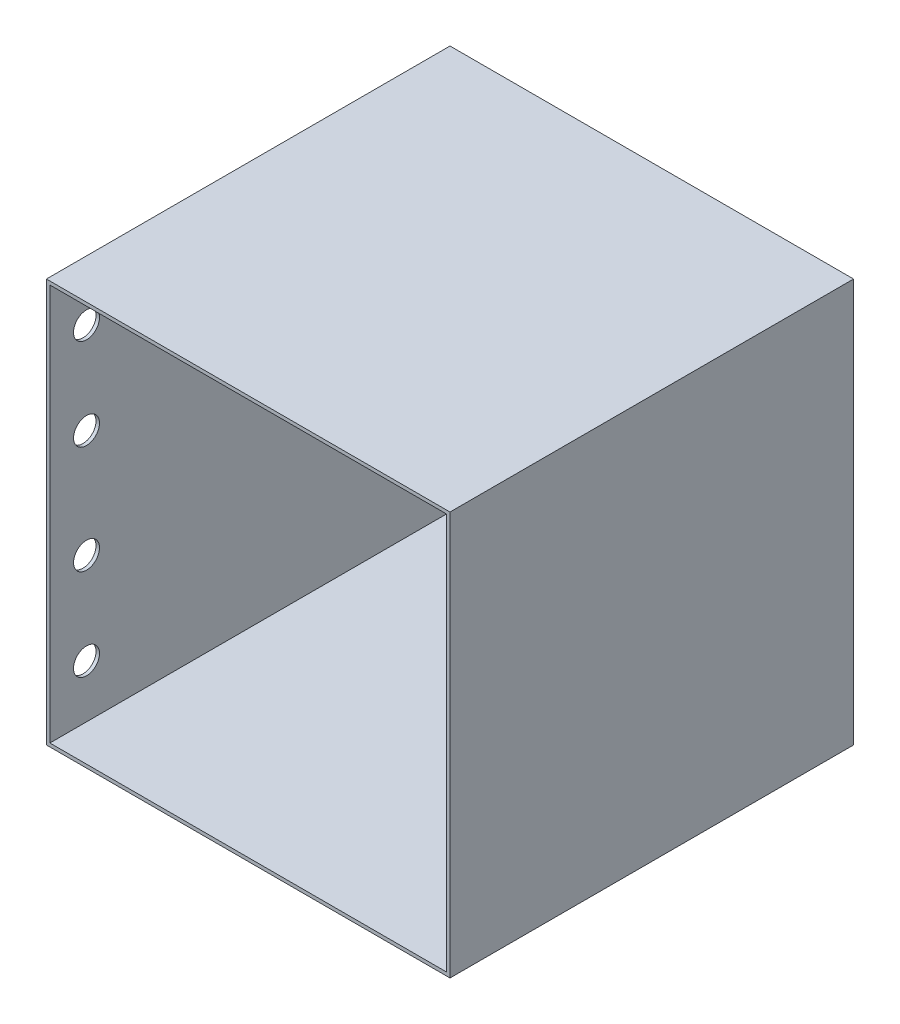
from build123d import *

# Parameters (mm, degrees)
CROQUIS1_W                        = 70
CROQUIS1_H                        = 70
SALIENTE_EXTRUIR1_DEPTH           = 70
VACIADO1_T                        = -0.6
TALADRO_DE_MARGEN_PARA_M41_REACH  = 173.7
TALADRO_DE_MARGEN_PARA_M41_BORE_R = 2.25


with BuildPart() as part:
    # Croquis1 → Saliente-Extruir1 (new body)
    with BuildSketch(Plane.XY):
        with Locations((35, 35)):
            Rectangle(CROQUIS1_W, CROQUIS1_H)
    extrude(amount=SALIENTE_EXTRUIR1_DEPTH)

    # Vaciado1
    vaciado1_openings = [part.faces().sort_by_distance(p)[0] for p in [
        (35, 35, 70),
        (35, 35, 0),
    ]]
    offset(amount=VACIADO1_T, openings=vaciado1_openings, kind=Kind.INTERSECTION)

    # Taladro de margen para M41 bore → Taladro de margen para M41 (cut, up to next)
    with BuildSketch(Plane(origin=(-1, -81.2, 39.730415546), x_dir=(0, 1, 0), z_dir=(-1, 0, 0)), mode=Mode.PRIVATE) as taladro_de_margen_para_m41_sk1:
        with Locations((90.9625, -23.919584454)):
            Circle(TALADRO_DE_MARGEN_PARA_M41_BORE_R)
    taladro_de_margen_para_m41_tool1 = extrude(taladro_de_margen_para_m41_sk1.sketch, amount=-TALADRO_DE_MARGEN_PARA_M41_REACH, mode=Mode.PRIVATE) & part.part
    # Taladro de margen para M41 bore → Taladro de margen para M41 (cut, up to next)
    with BuildSketch(Plane(origin=(-1, -81.2, 39.730415546), x_dir=(0, 1, 0), z_dir=(-1, 0, 0)), mode=Mode.PRIVATE) as taladro_de_margen_para_m41_sk2:
        with Locations((106.8375, -23.919584454)):
            Circle(TALADRO_DE_MARGEN_PARA_M41_BORE_R)
    taladro_de_margen_para_m41_tool2 = extrude(taladro_de_margen_para_m41_sk2.sketch, amount=-TALADRO_DE_MARGEN_PARA_M41_REACH, mode=Mode.PRIVATE) & part.part
    # Taladro de margen para M41 bore → Taladro de margen para M41 (cut, up to next)
    with BuildSketch(Plane(origin=(-1, -81.2, 39.730415546), x_dir=(0, 1, 0), z_dir=(-1, 0, 0)), mode=Mode.PRIVATE) as taladro_de_margen_para_m41_sk3:
        with Locations((125.5625, -23.919584454)):
            Circle(TALADRO_DE_MARGEN_PARA_M41_BORE_R)
    taladro_de_margen_para_m41_tool3 = extrude(taladro_de_margen_para_m41_sk3.sketch, amount=-TALADRO_DE_MARGEN_PARA_M41_REACH, mode=Mode.PRIVATE) & part.part
    # Taladro de margen para M41 bore → Taladro de margen para M41 (cut, up to next)
    with BuildSketch(Plane(origin=(-1, -81.2, 39.730415546), x_dir=(0, 1, 0), z_dir=(-1, 0, 0)), mode=Mode.PRIVATE) as taladro_de_margen_para_m41_sk4:
        with Locations((141.4375, -23.919584454)):
            Circle(TALADRO_DE_MARGEN_PARA_M41_BORE_R)
    taladro_de_margen_para_m41_tool4 = extrude(taladro_de_margen_para_m41_sk4.sketch, amount=-TALADRO_DE_MARGEN_PARA_M41_REACH, mode=Mode.PRIVATE) & part.part
    add(taladro_de_margen_para_m41_tool1.solids().sort_by_distance((-1, 9.7625, 63.65))[0], mode=Mode.SUBTRACT)
    add(taladro_de_margen_para_m41_tool2.solids().sort_by_distance((-1, 25.6375, 63.65))[0], mode=Mode.SUBTRACT)
    add(taladro_de_margen_para_m41_tool3.solids().sort_by_distance((-1, 44.3625, 63.65))[0], mode=Mode.SUBTRACT)
    add(taladro_de_margen_para_m41_tool4.solids().sort_by_distance((-1, 60.2375, 63.65))[0], mode=Mode.SUBTRACT)


solid = part.part
